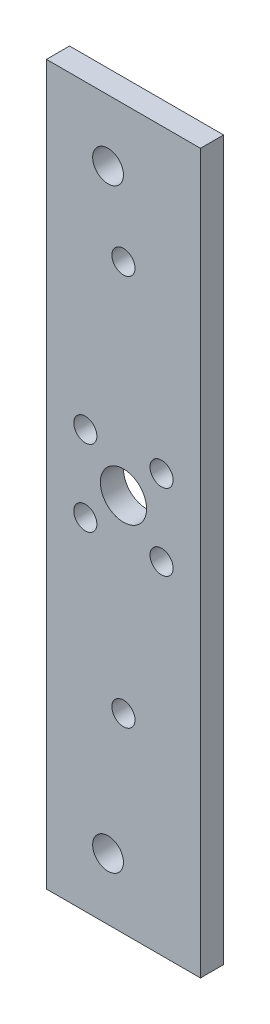
from build123d import *

# Parameters (mm, degrees)
SKETCH_1_W           = 170.943732818
SKETCH_1_H           = 105.520822726
EXTRUDE_1_DEPTH      = 3
SKETCH_3_OUTSIDE_W   = 213.126
SKETCH_3_OUTSIDE_H   = 147.702
SKETCH_3_OUTSIDE_W_2 = 20
SKETCH_3_OUTSIDE_H_2 = 88.50002898
CUT_EXTRUDE_1_DEPTH  = 101.489307663
SKETCH_2_R           = 1.5
SKETCH_2_R_2         = 3
CUT_EXTRUDE_2_DEPTH  = 58.243779886
SKETCH_4_R           = 1.5
CUT_EXTRUDE_3_DEPTH  = 58.243779886
SKETCH_9_W           = 20
SKETCH_9_H           = 3
EXTRUDE_3_DEPTH      = 5
SKETCH_10_W          = 20
SKETCH_10_H          = 3
EXTRUDE_4_DEPTH      = 5
SKETCH_11_R          = 2
CUT_EXTRUDE_4_DEPTH  = 5


with BuildPart() as part:
    # 草图1 → 凸台-拉伸1 (new body)
    with BuildSketch(Plane.XY):
        Rectangle(SKETCH_1_W, SKETCH_1_H)
    extrude(amount=EXTRUDE_1_DEPTH)

    # 草图3 outside → 切除-拉伸1 (cut, through all)
    with BuildSketch(Plane.XY.offset(3)):
        Rectangle(SKETCH_3_OUTSIDE_W, SKETCH_3_OUTSIDE_H)
        with Locations((-12.004302498, 13.711132511)):
            Rectangle(SKETCH_3_OUTSIDE_W_2, SKETCH_3_OUTSIDE_H_2, mode=Mode.SUBTRACT)
    extrude(amount=-CUT_EXTRUDE_1_DEPTH, mode=Mode.SUBTRACT)

    # 草图2 → 切除-拉伸2 (cut, through all)
    with BuildSketch(Plane(origin=(0, 0, 0), x_dir=(-1, 0, 0), z_dir=(0, 0, -1))):
        with Locations((7.05455503, 18.660879979)):
            Circle(SKETCH_2_R)
        with Locations((16.954049967, 18.660879979)):
            Circle(SKETCH_2_R)
        with Locations((16.954049967, 8.761385043)):
            Circle(SKETCH_2_R)
        with Locations((7.05455503, 8.761385043)):
            Circle(SKETCH_2_R)
        with Locations((12.004302498, 13.711132511)):
            Circle(SKETCH_2_R_2)
    extrude(amount=-CUT_EXTRUDE_2_DEPTH, mode=Mode.SUBTRACT)

    # 草图4 → 切除-拉伸3 (cut, through all)
    with BuildSketch(Plane(origin=(0, 0, 0), x_dir=(-1, 0, 0), z_dir=(0, 0, -1))):
        with Locations((12.004302498, 40.007436866)):
            Circle(SKETCH_4_R)
        with Locations((12.004302498, -10.785171844)):
            Circle(SKETCH_4_R)
    extrude(amount=-CUT_EXTRUDE_3_DEPTH, mode=Mode.SUBTRACT)

    # 草图9 → 凸台-拉伸3 (add)
    with BuildSketch(Plane(origin=(0, 52.760411363, 0), x_dir=(1, 0, 0), z_dir=(0, 1, 0))):
        with Locations((-12.004302498, -1.5)):
            Rectangle(SKETCH_9_W, SKETCH_9_H)
    extrude(amount=EXTRUDE_3_DEPTH)

    # 草图10 → 凸台-拉伸4 (add)
    with BuildSketch(Plane.XZ.offset(30.538881979)):
        with Locations((-12.004302498, 1.5)):
            Rectangle(SKETCH_10_W, SKETCH_10_H)
    extrude(amount=EXTRUDE_4_DEPTH)

    # 草图11 → 切除-拉伸4 (cut)
    with BuildSketch(Plane.XY.offset(3)):
        with Locations((-14.004302498, 49.760411363)):
            Circle(SKETCH_11_R)
        with Locations((-14.004302498, -27.538881979)):
            Circle(SKETCH_11_R)
    extrude(amount=-CUT_EXTRUDE_4_DEPTH, mode=Mode.SUBTRACT)


solid = part.part
